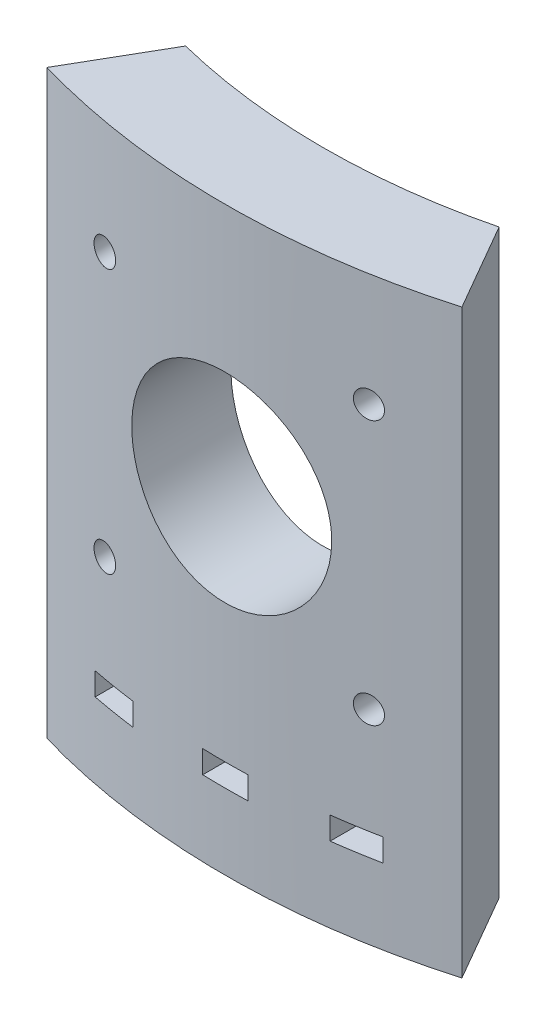
from build123d import *

# Parameters (mm, degrees)
EXTRUDE_1_DEPTH     = 77
SKETCH_2_R          = 1.75
CUT_EXTRUDE_1_DEPTH = 20
SKETCH_3_W          = 6
SKETCH_3_H          = 3
CUT_EXTRUDE_2_DEPTH = 84.228292678
SKETCH_4_R          = 13.25
CUT_EXTRUDE_3_DEPTH = 84.228292678
SKETCH_7_R          = 1.75
CUT_EXTRUDE_4_DEPTH = 84.228292822


with BuildPart() as part:
    # Эскиз1 → Бобышка-Вытянуть1 (new body)
    with BuildSketch(Plane(origin=(0, 0, 0), x_dir=(-1, 0, 0), z_dir=(0, 1, 0))):
        with BuildLine():
            Line((27.5, 9.103890562), (20.77355029, -2.54666209))
            ThreePointArc((20.77355029, -2.54666209), (0, 0), (-20.77355029, -2.54666209))
            Line((-20.77355029, -2.54666209), (-27.5, 9.103890562))
            ThreePointArc((-27.5, 9.103890562), (0, 13), (27.5, 9.103890562))
        make_face()
    extrude(amount=EXTRUDE_1_DEPTH)

    # Эскиз2 → Вырез-Вытянуть1 (cut)
    with BuildSketch(Plane.XZ):
        with Locations(Location((0, 6.5, 0), (0, 0, 270))):
            Circle(SKETCH_2_R)
        with Locations(Location((16.059644847, 5.07877185, 0), (0, 0, 270))):
            Circle(SKETCH_2_R)
        with Locations(Location((-16.059644847, 5.07877185, 0), (0, 0, 270))):
            Circle(SKETCH_2_R)
    extrude(amount=-CUT_EXTRUDE_1_DEPTH, mode=Mode.SUBTRACT)

    # Эскиз3 → Вырез-Вытянуть2 (cut, through all)
    with BuildSketch(Plane.XY.offset(13)):
        with Locations((-16.059644847, 11.5)):
            Rectangle(SKETCH_3_W, SKETCH_3_H)
        with Locations((0, 11.5)):
            Rectangle(SKETCH_3_W, SKETCH_3_H)
        with Locations((16.059644847, 11.5)):
            Rectangle(SKETCH_3_W, SKETCH_3_H)
    extrude(amount=-CUT_EXTRUDE_2_DEPTH, mode=Mode.SUBTRACT)

    # Эскиз4 → Вырез-Вытянуть3 (cut, through all)
    with BuildSketch(Plane.XY.offset(13)):
        with Locations((0, 44.5)):
            Circle(SKETCH_4_R)
    extrude(amount=-CUT_EXTRUDE_3_DEPTH, mode=Mode.SUBTRACT)

    # Эскиз7 → Вырез-Вытянуть4 (cut, through all)
    with BuildSketch(Plane.XY.offset(13)):
        with Locations((-17.5, 62)):
            Circle(SKETCH_7_R)
        with Locations((17.5, 62)):
            Circle(SKETCH_7_R)
        with Locations((17.5, 27)):
            Circle(SKETCH_7_R)
        with Locations((-17.5, 27)):
            Circle(SKETCH_7_R)
    extrude(amount=-CUT_EXTRUDE_4_DEPTH, mode=Mode.SUBTRACT)


solid = part.part
